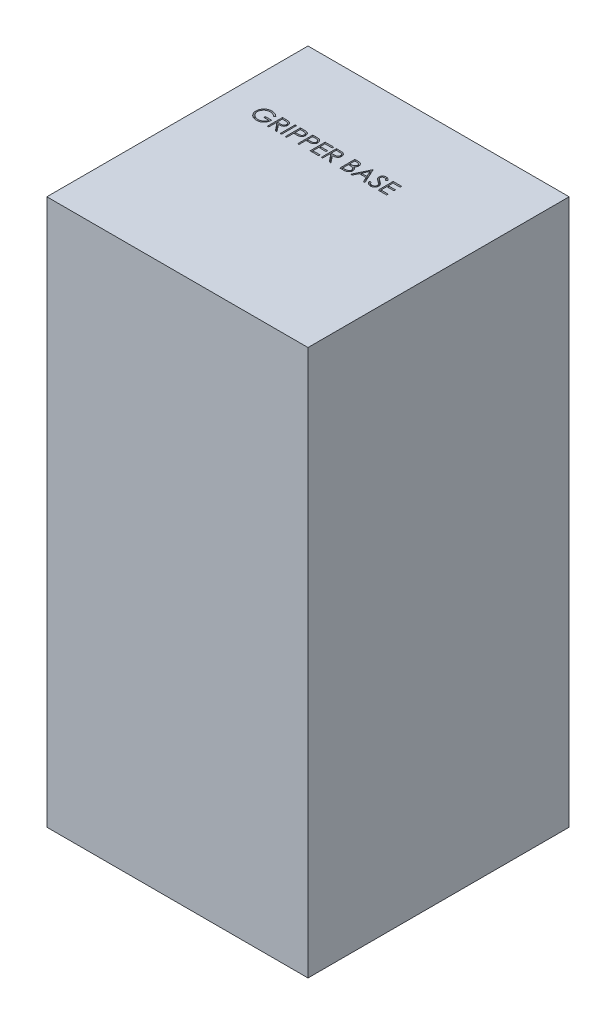
from build123d import *

# Parameters (mm, degrees)
SKETCH1_W           = 55
SKETCH1_H           = 55
BOSS_EXTRUDE1_DEPTH = 115
SKETCH2_W           = 0.284935897
SKETCH2_H           = 3.175
CUT_EXTRUDE1_DEPTH  = 1


with BuildPart() as part:
    # Sketch1 → Boss-Extrude1 (new body)
    with BuildSketch(Plane(origin=(0, 0, 0), x_dir=(1, 0, 0), z_dir=(0, 1, 0))):
        Rectangle(SKETCH1_W, SKETCH1_H)
    extrude(amount=BOSS_EXTRUDE1_DEPTH)

    # Sketch2 → Cut-Extrude1 (cut)
    # profile 1 of 11: a face of its own
    with BuildSketch(Plane(origin=(0, 115, 0), x_dir=(1, 0, 0), z_dir=(0, 1, 0))):
        with BuildLine():
            Line((-18.007065508, 11.228724722), (-18.251296277, 10.997214305))
            add(Edge.make_bspline(
                [(-18.251296277, 10.997214305), (-18.295491268, 11.038789445), (-18.382827396, 11.120948342), (-18.525212759, 11.227547602), (-18.67376977, 11.318866136), (-18.827723249, 11.393166793), (-18.983260652, 11.452451083), (-19.13831747, 11.494658753), (-19.291303214, 11.521575984), (-19.393054905, 11.524794862), (-19.443193312, 11.526380972)],
                knots=[0, 0, 0, 0, 1.08915593, 2.152340314, 3.188132944, 4.216796309, 5.218260357, 6.173443236, 7.099959455, 8, 8, 8, 8], degree=3))
            add(Edge.make_bspline(
                [(-19.443193312, 11.526380972), (-19.47395879, 11.526005772), (-19.535409954, 11.525256346), (-19.626688432, 11.515691237), (-19.717009595, 11.501934539), (-19.806202943, 11.482030121), (-19.894441895, 11.456803331), (-19.981419562, 11.425247947), (-20.067298191, 11.388458547), (-20.15126885, 11.345947588), (-20.232676307, 11.299248013), (-20.309562865, 11.247496837), (-20.382418591, 11.192352721), (-20.44987412, 11.132435046), (-20.512317467, 11.068286561), (-20.571234919, 11.001100562), (-20.624554323, 10.929041471), (-20.672715594, 10.853435082), (-20.715679348, 10.77560931), (-20.75360577, 10.696313241), (-20.785443842, 10.615809887), (-20.810634705, 10.533998231), (-20.831417941, 10.451511196), (-20.846038914, 10.367777628), (-20.854281869, 10.282707871), (-20.855707698, 10.225741786), (-20.856424482, 10.197104129)],
                knots=[0, 0, 0, 0, 1.02818874, 2.053710826, 3.065248034, 4.081641283, 5.106893873, 6.131558223, 7.173050175, 8.228653731, 9.27666206, 10.308777013, 11.325269123, 12.329503258, 13.32196095, 14.316845687, 15.314881793, 16.315733098, 17.311955233, 18.285320748, 19.252783886, 20.203351036, 21.145449891, 22.095197417, 23.042428769, 24, 24, 24, 24], degree=3))
            add(Edge.make_bspline(
                [(-20.856424482, 10.197104129), (-20.855738938, 10.167829888), (-20.854369721, 10.109361343), (-20.845606431, 10.022099577), (-20.829342956, 9.936133819), (-20.80760082, 9.851181584), (-20.780403937, 9.767097381), (-20.74650159, 9.684245747), (-20.706346367, 9.602629749), (-20.659867494, 9.522984768), (-20.608898581, 9.445403169), (-20.551800215, 9.372324174), (-20.491148114, 9.30277464), (-20.424732648, 9.238298769), (-20.354683492, 9.177171948), (-20.278907784, 9.121078296), (-20.198895552, 9.068937337), (-20.114524724, 9.021406208), (-20.026710772, 8.97894418), (-19.936670717, 8.94118536), (-19.844116913, 8.910089104), (-19.749535759, 8.884745252), (-19.653040005, 8.863971411), (-19.554139841, 8.850606947), (-19.453562456, 8.840908836), (-19.38576384, 8.840199749), (-19.351606774, 8.83984251)],
                knots=[0, 0, 0, 0, 0.93586088, 1.869166235, 2.799637598, 3.729985548, 4.670839027, 5.622275134, 6.589130586, 7.576015415, 8.568469353, 9.55398029, 10.53834874, 11.515998671, 12.510579167, 13.508179873, 14.527009472, 15.561807829, 16.601455013, 17.643573243, 18.680854198, 19.719860599, 20.772568776, 21.833555941, 22.908541556, 24, 24, 24, 24], degree=3))
            add(Edge.make_bspline(
                [(-19.351606774, 8.83984251), (-19.31044213, 8.840703005), (-19.229608665, 8.842392725), (-19.110785249, 8.855546559), (-18.996663892, 8.876090436), (-18.887565265, 8.906176642), (-18.783362653, 8.944552119), (-18.683674056, 8.990812219), (-18.589284337, 9.04673128), (-18.499909744, 9.109844717), (-18.417580012, 9.180161743), (-18.343326628, 9.256039213), (-18.278333934, 9.337108817), (-18.221633242, 9.422893067), (-18.174726106, 9.514102022), (-18.136224427, 9.610288704), (-18.106712084, 9.711496375), (-18.094597214, 9.781429499), (-18.088475764, 9.816765587)],
                knots=[0, 0, 0, 0, 1.13008108, 2.219097802, 3.278683437, 4.311054135, 5.322181354, 6.324827112, 7.324222904, 8.330512327, 9.32562643, 10.293043162, 11.24128371, 12.174520618, 13.111833804, 14.052305215, 15.015860969, 16, 16, 16, 16], degree=3))
            Line((-18.088475764, 9.816765587), (-19.146809098, 9.816765587))
            Line((-19.146809098, 9.816765587), (-19.146809098, 10.142406613))
            Line((-19.146809098, 10.142406613), (-17.803539867, 10.142406613))
            add(Edge.make_bspline(
                [(-17.803539867, 10.142406613), (-17.805087315, 10.081711962), (-17.808115951, 9.962921567), (-17.829360253, 9.78968425), (-17.863665232, 9.626061357), (-17.910528514, 9.471880571), (-17.971193947, 9.327360383), (-18.045010455, 9.192354061), (-18.133159451, 9.067733787), (-18.232501066, 8.952482191), (-18.343988884, 8.849676405), (-18.464610418, 8.75931959), (-18.594564954, 8.683207932), (-18.733729565, 8.62128576), (-18.881648672, 8.572958636), (-19.03866456, 8.53869442), (-19.204564298, 8.51816581), (-19.318262569, 8.515542916), (-19.376411461, 8.514201485)],
                knots=[0, 0, 0, 0, 1.140356446, 2.231883559, 3.274166699, 4.278491846, 5.25512956, 6.21435461, 7.1637429, 8.11826594, 9.068280886, 10.0076534, 10.945064095, 11.891975133, 12.864533718, 13.863980011, 14.907571808, 16, 16, 16, 16], degree=3))
            add(Edge.make_bspline(
                [(-19.376411461, 8.514201485), (-19.412252798, 8.514717759), (-19.482943467, 8.515736018), (-19.58734738, 8.522972612), (-19.68887265, 8.534112849), (-19.787504487, 8.550935925), (-19.883605697, 8.571541362), (-19.976696321, 8.597927171), (-20.067130972, 8.628469491), (-20.155049431, 8.663209138), (-20.239653698, 8.703460569), (-20.32132061, 8.748191456), (-20.400501595, 8.797171148), (-20.476657295, 8.851246701), (-20.550184509, 8.910013647), (-20.620609133, 8.973589773), (-20.688325422, 9.041780718), (-20.730743843, 9.090203105), (-20.752117591, 9.114602126)],
                knots=[0, 0, 0, 0, 1.107784379, 2.184907829, 3.233506516, 4.263428166, 5.276301166, 6.270063455, 7.25232949, 8.225834625, 9.190232166, 10.146266622, 11.1027726, 12.066435141, 13.031522626, 14.010570082, 14.99756817, 16, 16, 16, 16], degree=3))
            add(Edge.make_bspline(
                [(-20.752117591, 9.114602126), (-20.783129115, 9.153310504), (-20.844637404, 9.230084741), (-20.92381116, 9.353093262), (-20.991303861, 9.480457807), (-21.0460661, 9.612532934), (-21.088827078, 9.749195105), (-21.119494179, 9.890269691), (-21.13746222, 10.035938356), (-21.140050786, 10.134513274), (-21.14136038, 10.184383776)],
                knots=[0, 0, 0, 0, 1.023165419, 2.029347347, 3.013907458, 3.994755782, 4.975994455, 5.96558838, 6.970761222, 8, 8, 8, 8], degree=3))
            add(Edge.make_bspline(
                [(-21.14136038, 10.184383776), (-21.140877564, 10.221727449), (-21.139918068, 10.295940177), (-21.128283492, 10.406119306), (-21.111590778, 10.514342077), (-21.087055235, 10.620520025), (-21.056125052, 10.724724061), (-21.017522961, 10.827002571), (-20.972578663, 10.927415912), (-20.920340391, 11.025272921), (-20.862206632, 11.119275067), (-20.799114646, 11.209043931), (-20.730168523, 11.292944726), (-20.656494191, 11.372040007), (-20.577212635, 11.445336104), (-20.493066587, 11.513511619), (-20.403991197, 11.576658001), (-20.309706234, 11.633780637), (-20.211618977, 11.685091921), (-20.109964547, 11.730076421), (-20.004773975, 11.767254143), (-19.896835335, 11.798798928), (-19.785331602, 11.822126234), (-19.671071936, 11.839043311), (-19.553460763, 11.850618997), (-19.473962365, 11.851549958), (-19.433653048, 11.852021998)],
                knots=[0, 0, 0, 0, 1.008945113, 2.00506715, 2.99143336, 3.967273523, 4.948097931, 5.927297278, 6.919902385, 7.919676788, 8.923139349, 9.905703106, 10.883022732, 11.856032218, 12.825136022, 13.798837087, 14.781400844, 15.773989409, 16.776158564, 17.77167057, 18.775803737, 19.789618931, 20.80898985, 21.851988756, 22.910860228, 24, 24, 24, 24], degree=3))
            add(Edge.make_bspline(
                [(-19.433653048, 11.852021998), (-19.400779784, 11.851496316), (-19.335595965, 11.850453951), (-19.23859905, 11.843228877), (-19.143101387, 11.831777213), (-19.048961376, 11.816150057), (-18.956499601, 11.794865138), (-18.865452661, 11.769394122), (-18.775688575, 11.739737969), (-18.687488663, 11.704369516), (-18.600259878, 11.664225156), (-18.513517208, 11.619037266), (-18.427557035, 11.568033154), (-18.342230288, 11.511061376), (-18.256998902, 11.449100418), (-18.173210977, 11.380378156), (-18.08884402, 11.307604656), (-18.034595232, 11.255278675), (-18.007065508, 11.228724722)],
                knots=[0, 0, 0, 0, 0.985871117, 1.954866573, 2.915460327, 3.869826059, 4.81536089, 5.759505086, 6.70452669, 7.649098992, 8.607881297, 9.583363685, 10.581137262, 11.603961102, 12.659522466, 13.73993555, 14.853081303, 16, 16, 16, 16], degree=3))
        make_face()
    # profile 2 of 11: a face of its own
    with BuildSketch(Plane(origin=(0, 115, 0), x_dir=(1, 0, 0), z_dir=(0, 1, 0))):
        with BuildLine():
            Line((-17.152257815, 11.770611741), (-16.516876205, 11.770611741))
            add(Edge.make_bspline(
                [(-16.516876205, 11.770611741), (-16.474475324, 11.770470602), (-16.393060936, 11.770199601), (-16.276426612, 11.768688516), (-16.170447746, 11.764357493), (-16.075179748, 11.760630421), (-15.990624369, 11.75383416), (-15.916522326, 11.74733843), (-15.853214915, 11.73883518), (-15.814891893, 11.730938118), (-15.797540267, 11.727362542)],
                knots=[0, 0, 0, 0, 1.410062039, 2.707475311, 3.878576406, 4.937260626, 5.877586885, 6.699081471, 7.410979367, 8, 8, 8, 8], degree=3))
            add(Edge.make_bspline(
                [(-15.797540267, 11.727362542), (-15.774311401, 11.721623262), (-15.728349204, 11.710267137), (-15.662173072, 11.686264499), (-15.59911365, 11.658488125), (-15.539432881, 11.625863893), (-15.483429699, 11.588149629), (-15.43052666, 11.545996403), (-15.380483704, 11.499634867), (-15.335324653, 11.447896118), (-15.292744228, 11.393615855), (-15.256831688, 11.334920305), (-15.225874096, 11.273541633), (-15.201226555, 11.208855618), (-15.181380108, 11.141489583), (-15.167386305, 11.070833317), (-15.158994156, 10.997208718), (-15.158139759, 10.946991187), (-15.157706533, 10.921528208)],
                knots=[0, 0, 0, 0, 1.027469482, 2.033020251, 3.019912614, 3.986113645, 4.951240523, 5.91722682, 6.890402269, 7.87763091, 8.8651537, 9.85103654, 10.82876324, 11.815024772, 12.821070561, 13.842952187, 14.906261191, 16, 16, 16, 16], degree=3))
            add(Edge.make_bspline(
                [(-15.157706533, 10.921528208), (-15.159039125, 10.879223506), (-15.161639355, 10.796676075), (-15.185882842, 10.676877989), (-15.225594399, 10.565127683), (-15.28031624, 10.461565861), (-15.350002479, 10.368211204), (-15.433754253, 10.286214148), (-15.531618287, 10.217597942), (-15.622722023, 10.170015755), (-15.703198476, 10.139542188), (-15.769450124, 10.118100633), (-15.841719453, 10.101534422), (-15.919314036, 10.086693445), (-16.00255678, 10.075488694), (-16.091248173, 10.067282141), (-16.185451468, 10.062153111), (-16.250166195, 10.061389292), (-16.283457735, 10.060996357)],
                knots=[0, 0, 0, 0, 1.260483769, 2.459530307, 3.627416485, 4.787058657, 5.939039949, 7.08810263, 8.267026773, 9.491475466, 10.141966685, 10.831826277, 11.566392101, 12.351337768, 13.187381173, 14.07005841, 15.007169909, 16, 16, 16, 16], degree=3))
            Line((-16.283457735, 10.060996357), (-15.117001405, 8.595611741))
            Line((-15.117001405, 8.595611741), (-15.469355171, 8.595611741))
            Line((-15.469355171, 8.595611741), (-16.635811501, 10.060996357))
            Line((-16.635811501, 10.060996357), (-16.867321918, 10.060996357))
            Line((-16.867321918, 10.060996357), (-16.867321918, 8.595611741))
            Line((-16.867321918, 8.595611741), (-17.152257815, 8.595611741))
            Line((-17.152257815, 8.595611741), (-17.152257815, 11.770611741))
        make_face()
        with BuildLine():
            Line((-16.867321918, 11.444970716), (-16.867321918, 10.386637382))
            Line((-16.867321918, 10.386637382), (-16.286001806, 10.382185259))
            add(Edge.make_bspline(
                [(-16.286001806, 10.382185259), (-16.258860056, 10.382173251), (-16.206251615, 10.382149977), (-16.130141726, 10.385772903), (-16.059275625, 10.389894342), (-15.993924371, 10.396198391), (-15.934058771, 10.404322827), (-15.879708746, 10.414485534), (-15.830785577, 10.42632562), (-15.773727618, 10.44465138), (-15.71001305, 10.473685411), (-15.640769511, 10.515926971), (-15.581803105, 10.569057529), (-15.531984758, 10.629812021), (-15.49195306, 10.696610618), (-15.463729982, 10.76865261), (-15.445820766, 10.844119274), (-15.443708443, 10.895987986), (-15.442642431, 10.922164225)],
                knots=[0, 0, 0, 0, 1.146690395, 2.22261258, 3.21895312, 4.145990853, 4.996080663, 5.770904154, 6.481378293, 7.121626537, 8.300444488, 9.431385265, 10.535395872, 11.636531494, 12.74115979, 13.810798291, 14.895190096, 16, 16, 16, 16], degree=3))
            add(Edge.make_bspline(
                [(-15.442642431, 10.922164225), (-15.443732926, 10.947697189), (-15.445893891, 10.998294205), (-15.463536702, 11.072367781), (-15.49337207, 11.142278514), (-15.533578671, 11.207742011), (-15.582563619, 11.267165072), (-15.64000192, 11.318007846), (-15.704323062, 11.359962718), (-15.764440506, 11.386772763), (-15.818174399, 11.403210058), (-15.864828447, 11.414777185), (-15.917543859, 11.424070382), (-15.976576597, 11.431516266), (-16.041674648, 11.437916108), (-16.113167167, 11.44222665), (-16.190579817, 11.444779227), (-16.244234534, 11.444905401), (-16.272009418, 11.444970716)],
                knots=[0, 0, 0, 0, 1.101028733, 2.181837193, 3.264309656, 4.369019818, 5.486613113, 6.575447106, 7.666700264, 8.788928104, 9.402425223, 10.0903467, 10.862060571, 11.710948788, 12.657782767, 13.684531032, 14.801375019, 16, 16, 16, 16], degree=3))
            Line((-16.272009418, 11.444970716), (-16.867321918, 11.444970716))
        make_face(mode=Mode.SUBTRACT)
    # profile 3 of 11: a face of its own
    with BuildSketch(Plane(origin=(0, 115, 0), x_dir=(1, 0, 0), z_dir=(0, 1, 0))):
        with Locations((-14.323251406, 10.183111741)):
            Rectangle(SKETCH2_W, SKETCH2_H)
    # profile 4 of 11: a face of its own
    with BuildSketch(Plane(origin=(0, 115, 0), x_dir=(1, 0, 0), z_dir=(0, 1, 0))):
        with BuildLine():
            Line((-13.366680892, 11.770611741), (-12.744019634, 11.770611741))
            add(Edge.make_bspline(
                [(-12.744019634, 11.770611741), (-12.701192598, 11.770564664), (-12.619134095, 11.770474462), (-12.501464008, 11.767739657), (-12.394593752, 11.764086872), (-12.298753763, 11.759023297), (-12.21364916, 11.753039247), (-12.139665038, 11.744646326), (-12.076219869, 11.735883058), (-12.038204733, 11.726973639), (-12.020867591, 11.722910419)],
                knots=[0, 0, 0, 0, 1.415646017, 2.712440637, 3.8905458, 4.950247383, 5.884950622, 6.709939814, 7.411656543, 8, 8, 8, 8], degree=3))
            add(Edge.make_bspline(
                [(-12.020867591, 11.722910419), (-11.9989206, 11.716903365), (-11.95554377, 11.705030804), (-11.893040681, 11.681251212), (-11.833573979, 11.653055248), (-11.776939636, 11.620920674), (-11.723833604, 11.58346877), (-11.673463552, 11.542217702), (-11.626273999, 11.496215065), (-11.582530308, 11.445976822), (-11.54235767, 11.392346346), (-11.507768601, 11.334523038), (-11.478806045, 11.273480212), (-11.453965505, 11.20926033), (-11.436087122, 11.141324108), (-11.422618863, 11.07014359), (-11.414070286, 10.995726407), (-11.413251534, 10.944872099), (-11.412834739, 10.918984137)],
                knots=[0, 0, 0, 0, 0.999701418, 1.975846123, 2.934577507, 3.890451536, 4.834027766, 5.787354733, 6.749476667, 7.726910423, 8.712836071, 9.690891519, 10.682875813, 11.679750201, 12.712814741, 13.765529915, 14.8625177, 16, 16, 16, 16], degree=3))
            add(Edge.make_bspline(
                [(-11.412834739, 10.918984137), (-11.413217031, 10.892878582), (-11.413965012, 10.841801302), (-11.422942357, 10.767077415), (-11.435034745, 10.69566859), (-11.453628499, 10.62773316), (-11.47798136, 10.563674568), (-11.506549151, 10.502513879), (-11.541005639, 10.445291605), (-11.580597734, 10.391800006), (-11.624640966, 10.341988871), (-11.672948989, 10.296219164), (-11.725326776, 10.2547588), (-11.781607867, 10.217514831), (-11.842340944, 10.185350921), (-11.906604898, 10.156542508), (-11.974958309, 10.132348046), (-12.022259018, 10.119620776), (-12.046308296, 10.113149802)],
                knots=[0, 0, 0, 0, 1.121902311, 2.195077645, 3.232258892, 4.234102512, 5.217864754, 6.176164875, 7.132989551, 8.084763148, 9.034132444, 9.988522005, 10.94243251, 11.903244335, 12.886203696, 13.894208494, 14.929344452, 16, 16, 16, 16], degree=3))
            add(Edge.make_bspline(
                [(-12.046308296, 10.113149802), (-12.066199521, 10.108919812), (-12.109792295, 10.099649543), (-12.181586051, 10.089300443), (-12.265175079, 10.080467048), (-12.36044529, 10.073843873), (-12.467311168, 10.068173896), (-12.585830523, 10.063667125), (-12.716236008, 10.061190758), (-12.80719635, 10.061063039), (-12.854686702, 10.060996357)],
                knots=[0, 0, 0, 0, 0.601384939, 1.31797006, 2.144135048, 3.087295005, 4.142315834, 5.309527816, 6.595305764, 8, 8, 8, 8], degree=3))
            Line((-12.854686702, 10.060996357), (-13.081744995, 10.060996357))
            Line((-13.081744995, 10.060996357), (-13.081744995, 8.595611741))
            Line((-13.081744995, 8.595611741), (-13.366680892, 8.595611741))
            Line((-13.366680892, 8.595611741), (-13.366680892, 11.770611741))
        make_face()
        with BuildLine():
            Line((-13.081744995, 11.444970716), (-13.081744995, 10.386637382))
            Line((-13.081744995, 10.386637382), (-12.525865588, 10.379641188))
            add(Edge.make_bspline(
                [(-12.525865588, 10.379641188), (-12.498723941, 10.379627161), (-12.446327551, 10.37960008), (-12.370638977, 10.383215247), (-12.300417695, 10.387388588), (-12.235879402, 10.393499033), (-12.176995004, 10.402136173), (-12.123666317, 10.410855393), (-12.076306853, 10.423469543), (-12.020881149, 10.440454042), (-11.959119826, 10.469421486), (-11.891929979, 10.511467458), (-11.83498809, 10.5650621), (-11.785713635, 10.625321633), (-11.746610446, 10.6923587), (-11.717984653, 10.764085521), (-11.701165174, 10.839766499), (-11.698909841, 10.891553596), (-11.697770636, 10.917712102)],
                knots=[0, 0, 0, 0, 1.160613943, 2.240541288, 3.23993089, 4.169200891, 5.011653406, 5.7853311, 6.478053781, 7.106038997, 8.262395093, 9.384106736, 10.481365981, 11.59014053, 12.70357646, 13.786202915, 14.881775077, 16, 16, 16, 16], degree=3))
            add(Edge.make_bspline(
                [(-11.697770636, 10.917712102), (-11.698916037, 10.943237753), (-11.701192952, 10.993979589), (-11.718116485, 11.068346036), (-11.746554791, 11.139316997), (-11.78597613, 11.20551401), (-11.833819869, 11.265556711), (-11.889427131, 11.317714819), (-11.952667018, 11.359644506), (-12.011493627, 11.386707555), (-12.063746132, 11.403231412), (-12.109132267, 11.414792803), (-12.160377379, 11.424023531), (-12.21749815, 11.431497937), (-12.280051849, 11.437896434), (-12.348575892, 11.442237999), (-12.422810697, 11.44477932), (-12.474346001, 11.444905373), (-12.5010609, 11.444970716)],
                knots=[0, 0, 0, 0, 1.120700087, 2.227813068, 3.331159281, 4.466773991, 5.599788987, 6.693661531, 7.80175334, 8.91857717, 9.525282508, 10.207424825, 10.974604443, 11.810962634, 12.737642355, 13.736264703, 14.826523623, 16, 16, 16, 16], degree=3))
            Line((-12.5010609, 11.444970716), (-13.081744995, 11.444970716))
        make_face(mode=Mode.SUBTRACT)
    # profile 5 of 11: a face of its own
    with BuildSketch(Plane(origin=(0, 115, 0), x_dir=(1, 0, 0), z_dir=(0, 1, 0))):
        with BuildLine():
            Line((-10.761552687, 11.770611741), (-10.138891429, 11.770611741))
            add(Edge.make_bspline(
                [(-10.138891429, 11.770611741), (-10.096064393, 11.770564664), (-10.01400589, 11.770474462), (-9.896335803, 11.767739657), (-9.789465547, 11.764086872), (-9.693625558, 11.759023297), (-9.608520955, 11.753039247), (-9.534536833, 11.744646326), (-9.471091664, 11.735883058), (-9.433076528, 11.726973639), (-9.415739386, 11.722910419)],
                knots=[0, 0, 0, 0, 1.415646017, 2.712440637, 3.8905458, 4.950247383, 5.884950622, 6.709939814, 7.411656543, 8, 8, 8, 8], degree=3))
            add(Edge.make_bspline(
                [(-9.415739386, 11.722910419), (-9.393792395, 11.716903365), (-9.350415565, 11.705030804), (-9.287912476, 11.681251212), (-9.228445774, 11.653055248), (-9.171811431, 11.620920674), (-9.118705399, 11.58346877), (-9.068335347, 11.542217702), (-9.021145794, 11.496215065), (-8.977402103, 11.445976822), (-8.937229465, 11.392346346), (-8.902640395, 11.334523038), (-8.873677839, 11.273480212), (-8.8488373, 11.20926033), (-8.830958917, 11.141324108), (-8.817490658, 11.07014359), (-8.808942081, 10.995726407), (-8.808123329, 10.944872099), (-8.807706533, 10.918984137)],
                knots=[0, 0, 0, 0, 0.999701418, 1.975846123, 2.934577507, 3.890451536, 4.834027766, 5.787354733, 6.749476667, 7.726910423, 8.712836071, 9.690891519, 10.682875813, 11.679750201, 12.712814741, 13.765529915, 14.8625177, 16, 16, 16, 16], degree=3))
            add(Edge.make_bspline(
                [(-8.807706533, 10.918984137), (-8.808088826, 10.892878582), (-8.808836807, 10.841801302), (-8.817814151, 10.767077415), (-8.82990654, 10.69566859), (-8.848500294, 10.62773316), (-8.872853155, 10.563674568), (-8.901420946, 10.502513879), (-8.935877434, 10.445291605), (-8.975469529, 10.391800006), (-9.019512761, 10.341988871), (-9.067820784, 10.296219164), (-9.120198571, 10.2547588), (-9.176479662, 10.217514831), (-9.237212739, 10.185350921), (-9.301476693, 10.156542508), (-9.369830103, 10.132348046), (-9.417130813, 10.119620776), (-9.441180091, 10.113149802)],
                knots=[0, 0, 0, 0, 1.121902311, 2.195077645, 3.232258892, 4.234102512, 5.217864754, 6.176164875, 7.132989551, 8.084763148, 9.034132444, 9.988522005, 10.94243251, 11.903244335, 12.886203696, 13.894208494, 14.929344452, 16, 16, 16, 16], degree=3))
            add(Edge.make_bspline(
                [(-9.441180091, 10.113149802), (-9.461071316, 10.108919812), (-9.50466409, 10.099649543), (-9.576457845, 10.089300443), (-9.660046874, 10.080467048), (-9.755317085, 10.073843873), (-9.862182963, 10.068173896), (-9.980702318, 10.063667125), (-10.111107802, 10.061190758), (-10.202068145, 10.061063039), (-10.249558497, 10.060996357)],
                knots=[0, 0, 0, 0, 0.601384939, 1.31797006, 2.144135048, 3.087295005, 4.142315834, 5.309527816, 6.595305764, 8, 8, 8, 8], degree=3))
            Line((-10.249558497, 10.060996357), (-10.47661679, 10.060996357))
            Line((-10.47661679, 10.060996357), (-10.47661679, 8.595611741))
            Line((-10.47661679, 8.595611741), (-10.761552687, 8.595611741))
            Line((-10.761552687, 8.595611741), (-10.761552687, 11.770611741))
        make_face()
        with BuildLine():
            Line((-10.47661679, 11.444970716), (-10.47661679, 10.386637382))
            Line((-10.47661679, 10.386637382), (-9.920737383, 10.379641188))
            add(Edge.make_bspline(
                [(-9.920737383, 10.379641188), (-9.893595736, 10.379627161), (-9.841199346, 10.37960008), (-9.765510772, 10.383215247), (-9.69528949, 10.387388588), (-9.630751197, 10.393499033), (-9.571866799, 10.402136173), (-9.518538112, 10.410855393), (-9.471178648, 10.423469543), (-9.415752944, 10.440454042), (-9.353991621, 10.469421486), (-9.286801774, 10.511467458), (-9.229859885, 10.5650621), (-9.18058543, 10.625321633), (-9.14148224, 10.6923587), (-9.112856447, 10.764085521), (-9.096036969, 10.839766499), (-9.093781636, 10.891553596), (-9.092642431, 10.917712102)],
                knots=[0, 0, 0, 0, 1.160613943, 2.240541288, 3.23993089, 4.169200891, 5.011653406, 5.7853311, 6.478053781, 7.106038997, 8.262395093, 9.384106736, 10.481365981, 11.59014053, 12.70357646, 13.786202915, 14.881775077, 16, 16, 16, 16], degree=3))
            add(Edge.make_bspline(
                [(-9.092642431, 10.917712102), (-9.093787832, 10.943237753), (-9.096064747, 10.993979589), (-9.11298828, 11.068346036), (-9.141426586, 11.139316997), (-9.180847925, 11.20551401), (-9.228691664, 11.265556711), (-9.284298926, 11.317714819), (-9.347538813, 11.359644506), (-9.406365422, 11.386707555), (-9.458617927, 11.403231412), (-9.504004062, 11.414792803), (-9.555249174, 11.424023531), (-9.612369945, 11.431497937), (-9.674923644, 11.437896434), (-9.743447687, 11.442237999), (-9.817682492, 11.44477932), (-9.869217796, 11.444905373), (-9.895932695, 11.444970716)],
                knots=[0, 0, 0, 0, 1.120700087, 2.227813068, 3.331159281, 4.466773991, 5.599788987, 6.693661531, 7.80175334, 8.91857717, 9.525282508, 10.207424825, 10.974604443, 11.810962634, 12.737642355, 13.736264703, 14.826523623, 16, 16, 16, 16], degree=3))
            Line((-9.895932695, 11.444970716), (-10.47661679, 11.444970716))
        make_face(mode=Mode.SUBTRACT)
    # profile 6 of 11: a face of its own
    with BuildSketch(Plane(origin=(0, 115, 0), x_dir=(1, 0, 0), z_dir=(0, 1, 0))):
        Polygon((-8.156424482, 11.770611741), (-6.365398841, 11.770611741), (-6.365398841, 11.444970716), (-7.871488585, 11.444970716), (-7.871488585, 10.468047639), (-6.365398841, 10.468047639), (-6.365398841, 10.142406613), (-7.871488585, 10.142406613), (-7.871488585, 8.921252767), (-6.365398841, 8.921252767), (-6.365398841, 8.595611741), (-8.156424482, 8.595611741), align=None)
    # profile 7 of 11: a face of its own
    with BuildSketch(Plane(origin=(0, 115, 0), x_dir=(1, 0, 0), z_dir=(0, 1, 0))):
        with BuildLine():
            Line((-5.795527046, 11.770611741), (-5.160145436, 11.770611741))
            add(Edge.make_bspline(
                [(-5.160145436, 11.770611741), (-5.117744555, 11.770470602), (-5.036330167, 11.770199601), (-4.919695843, 11.768688516), (-4.813716976, 11.764357493), (-4.718448979, 11.760630421), (-4.633893599, 11.75383416), (-4.559791557, 11.74733843), (-4.496484146, 11.73883518), (-4.458161123, 11.730938118), (-4.440809498, 11.727362542)],
                knots=[0, 0, 0, 0, 1.410062039, 2.707475311, 3.878576406, 4.937260626, 5.877586885, 6.699081471, 7.410979367, 8, 8, 8, 8], degree=3))
            add(Edge.make_bspline(
                [(-4.440809498, 11.727362542), (-4.417580632, 11.721623262), (-4.371618434, 11.710267137), (-4.305442303, 11.686264499), (-4.242382881, 11.658488125), (-4.182702111, 11.625863893), (-4.126698929, 11.588149629), (-4.07379589, 11.545996403), (-4.023752934, 11.499634867), (-3.978593884, 11.447896118), (-3.936013459, 11.393615855), (-3.900100919, 11.334920305), (-3.869143327, 11.273541633), (-3.844495786, 11.208855618), (-3.824649339, 11.141489583), (-3.810655536, 11.070833317), (-3.802263387, 10.997208718), (-3.80140899, 10.946991187), (-3.800975764, 10.921528208)],
                knots=[0, 0, 0, 0, 1.027469482, 2.033020251, 3.019912614, 3.986113645, 4.951240523, 5.91722682, 6.890402269, 7.87763091, 8.8651537, 9.85103654, 10.82876324, 11.815024772, 12.821070561, 13.842952187, 14.906261191, 16, 16, 16, 16], degree=3))
            add(Edge.make_bspline(
                [(-3.800975764, 10.921528208), (-3.802308355, 10.879223506), (-3.804908586, 10.796676075), (-3.829152073, 10.676877989), (-3.86886363, 10.565127683), (-3.923585471, 10.461565861), (-3.993271709, 10.368211204), (-4.077023484, 10.286214148), (-4.174887517, 10.217597942), (-4.265991254, 10.170015755), (-4.346467707, 10.139542188), (-4.412719355, 10.118100633), (-4.484988684, 10.101534422), (-4.562583266, 10.086693445), (-4.645826011, 10.075488694), (-4.734517404, 10.067282141), (-4.828720699, 10.062153111), (-4.893435426, 10.061389292), (-4.926726966, 10.060996357)],
                knots=[0, 0, 0, 0, 1.260483769, 2.459530307, 3.627416485, 4.787058657, 5.939039949, 7.08810263, 8.267026773, 9.491475466, 10.141966685, 10.831826277, 11.566392101, 12.351337768, 13.187381173, 14.07005841, 15.007169909, 16, 16, 16, 16], degree=3))
            Line((-4.926726966, 10.060996357), (-3.760270636, 8.595611741))
            Line((-3.760270636, 8.595611741), (-4.112624402, 8.595611741))
            Line((-4.112624402, 8.595611741), (-5.279080732, 10.060996357))
            Line((-5.279080732, 10.060996357), (-5.510591149, 10.060996357))
            Line((-5.510591149, 10.060996357), (-5.510591149, 8.595611741))
            Line((-5.510591149, 8.595611741), (-5.795527046, 8.595611741))
            Line((-5.795527046, 8.595611741), (-5.795527046, 11.770611741))
        make_face()
        with BuildLine():
            Line((-5.510591149, 11.444970716), (-5.510591149, 10.386637382))
            Line((-5.510591149, 10.386637382), (-4.929271037, 10.382185259))
            add(Edge.make_bspline(
                [(-4.929271037, 10.382185259), (-4.902129287, 10.382173251), (-4.849520846, 10.382149977), (-4.773410957, 10.385772903), (-4.702544856, 10.389894342), (-4.637193602, 10.396198391), (-4.577328002, 10.404322827), (-4.522977977, 10.414485534), (-4.474054808, 10.42632562), (-4.416996848, 10.44465138), (-4.353282281, 10.473685411), (-4.284038742, 10.515926971), (-4.225072336, 10.569057529), (-4.175253989, 10.629812021), (-4.135222291, 10.696610618), (-4.106999213, 10.76865261), (-4.089089997, 10.844119274), (-4.086977674, 10.895987986), (-4.085911662, 10.922164225)],
                knots=[0, 0, 0, 0, 1.146690395, 2.22261258, 3.21895312, 4.145990853, 4.996080663, 5.770904154, 6.481378293, 7.121626537, 8.300444488, 9.431385265, 10.535395872, 11.636531494, 12.74115979, 13.810798291, 14.895190096, 16, 16, 16, 16], degree=3))
            add(Edge.make_bspline(
                [(-4.085911662, 10.922164225), (-4.087002157, 10.947697189), (-4.089163121, 10.998294205), (-4.106805933, 11.072367781), (-4.1366413, 11.142278514), (-4.176847902, 11.207742011), (-4.22583285, 11.267165072), (-4.283271151, 11.318007846), (-4.347592292, 11.359962718), (-4.407709737, 11.386772763), (-4.461443629, 11.403210058), (-4.508097678, 11.414777185), (-4.56081309, 11.424070382), (-4.619845828, 11.431516266), (-4.684943878, 11.437916108), (-4.756436398, 11.44222665), (-4.833849048, 11.444779227), (-4.887503764, 11.444905401), (-4.915278649, 11.444970716)],
                knots=[0, 0, 0, 0, 1.101028733, 2.181837193, 3.264309656, 4.369019818, 5.486613113, 6.575447106, 7.666700264, 8.788928104, 9.402425223, 10.0903467, 10.862060571, 11.710948788, 12.657782767, 13.684531032, 14.801375019, 16, 16, 16, 16], degree=3))
            Line((-4.915278649, 11.444970716), (-5.510591149, 11.444970716))
        make_face(mode=Mode.SUBTRACT)
    # profile 8 of 11: a face of its own
    with BuildSketch(Plane(origin=(0, 115, 0), x_dir=(1, 0, 0), z_dir=(0, 1, 0))):
        with BuildLine():
            Line((-1.887834739, 11.770611741), (-1.268353569, 11.770611741))
            add(Edge.make_bspline(
                [(-1.268353569, 11.770611741), (-1.238029163, 11.77045231), (-1.179252919, 11.770143294), (-1.093782425, 11.765350739), (-1.013728147, 11.758815982), (-0.939066868, 11.748447255), (-0.869833088, 11.735936143), (-0.80581816, 11.72078521), (-0.747225647, 11.70261821), (-0.677273378, 11.673729083), (-0.597516779, 11.630800209), (-0.511158237, 11.567365011), (-0.437312963, 11.489774848), (-0.373643946, 11.402251296), (-0.323024359, 11.305970989), (-0.28640364, 11.203228725), (-0.263218996, 11.095349716), (-0.26083463, 11.021287691), (-0.25962961, 10.983857935)],
                knots=[0, 0, 0, 0, 1.001505555, 1.941167018, 2.826882275, 3.653841531, 4.429895133, 5.150066043, 5.825578002, 6.45369114, 7.647487171, 8.808567382, 9.977351308, 11.170798116, 12.373658725, 13.556498008, 14.765093433, 16, 16, 16, 16], degree=3))
            add(Edge.make_bspline(
                [(-0.25962961, 10.983857935), (-0.260621316, 10.948794545), (-0.26257011, 10.879891678), (-0.281205328, 10.77911345), (-0.310379648, 10.683181987), (-0.350933696, 10.592447395), (-0.403640506, 10.50895976), (-0.466104838, 10.432045597), (-0.541467366, 10.364961424), (-0.597930877, 10.327457505), (-0.626611782, 10.308407214)],
                knots=[0, 0, 0, 0, 1.044552857, 2.05264487, 3.044412934, 4.028983338, 5.005914585, 5.980388656, 6.974128949, 8, 8, 8, 8], degree=3))
            add(Edge.make_bspline(
                [(-0.626611782, 10.308407214), (-0.590543394, 10.294559679), (-0.521535633, 10.268065915), (-0.426570465, 10.221225173), (-0.344750855, 10.170278115), (-0.27544773, 10.114641366), (-0.216177143, 10.05467123), (-0.164421975, 9.989488376), (-0.120261014, 9.918242503), (-0.082421433, 9.841676439), (-0.052895062, 9.760572), (-0.030782634, 9.675689939), (-0.018112162, 9.587334628), (-0.016309088, 9.527204319), (-0.015398841, 9.49684872)],
                knots=[0, 0, 0, 0, 1.27268992, 2.434971085, 3.483601985, 4.442670788, 5.356604649, 6.2567628, 7.179492994, 8.113709626, 9.066344395, 10.018646069, 10.999752585, 12, 12, 12, 12], degree=3))
            add(Edge.make_bspline(
                [(-0.015398841, 9.49684872), (-0.01628498, 9.465854486), (-0.018028483, 9.404872463), (-0.030891743, 9.315287448), (-0.052671433, 9.229675889), (-0.082671687, 9.147484045), (-0.121826073, 9.068870923), (-0.16947644, 8.993747462), (-0.226292216, 8.922868462), (-0.289849247, 8.855446318), (-0.361751336, 8.794823968), (-0.439326342, 8.74083472), (-0.523551218, 8.696433649), (-0.61304267, 8.659135544), (-0.708804585, 8.630644728), (-0.810406951, 8.610712465), (-0.917762139, 8.597282181), (-0.991430984, 8.596178003), (-1.02921094, 8.595611741)],
                knots=[0, 0, 0, 0, 0.978564426, 1.925352924, 2.850884081, 3.763762016, 4.682927383, 5.618979971, 6.567305752, 7.547517671, 8.540179244, 9.531824382, 10.526200242, 11.540722885, 12.589160233, 13.674978461, 14.80764778, 16, 16, 16, 16], degree=3))
            Line((-1.02921094, 8.595611741), (-1.887834739, 8.595611741))
            Line((-1.887834739, 8.595611741), (-1.887834739, 11.770611741))
        make_face()
        with BuildLine():
            Line((-1.602898841, 11.444970716), (-1.602898841, 10.42734251))
            Line((-1.602898841, 10.42734251), (-1.411457535, 10.42734251))
            add(Edge.make_bspline(
                [(-1.411457535, 10.42734251), (-1.383473271, 10.427705298), (-1.329401969, 10.428406277), (-1.251097491, 10.430414253), (-1.178412654, 10.436036764), (-1.111472919, 10.441657659), (-1.050383702, 10.450796749), (-0.995280342, 10.461675317), (-0.945298043, 10.473180524), (-0.887658599, 10.49274713), (-0.822278138, 10.521664736), (-0.752579537, 10.566542758), (-0.691134696, 10.619995564), (-0.639248676, 10.68167308), (-0.596783985, 10.749587406), (-0.5672894, 10.822654933), (-0.547289364, 10.899054624), (-0.545482761, 10.951504039), (-0.544565508, 10.978133776)],
                knots=[0, 0, 0, 0, 1.156816544, 2.235205308, 3.236616184, 4.169592532, 5.011045266, 5.787822928, 6.49130361, 7.128639758, 8.301311294, 9.436451833, 10.541879658, 11.654887649, 12.756523258, 13.837046038, 14.901820046, 16, 16, 16, 16], degree=3))
            add(Edge.make_bspline(
                [(-0.544565508, 10.978133776), (-0.545042828, 10.995755726), (-0.545979145, 11.030323105), (-0.553647498, 11.080714305), (-0.56668094, 11.128106852), (-0.583421621, 11.173150224), (-0.606815646, 11.214435973), (-0.634359644, 11.253391587), (-0.667638806, 11.288690437), (-0.705518654, 11.321682768), (-0.749069334, 11.350933161), (-0.798264863, 11.376551567), (-0.853770827, 11.3971807), (-0.914651774, 11.415247496), (-0.981844832, 11.427936877), (-1.054574605, 11.438508164), (-1.133436815, 11.443890009), (-1.187997015, 11.444602445), (-1.216200123, 11.444970716)],
                knots=[0, 0, 0, 0, 0.91205012, 1.789085906, 2.630437955, 3.453916878, 4.269457761, 5.079663411, 5.91843418, 6.774407191, 7.675494373, 8.627863946, 9.638891023, 10.736472738, 11.911756761, 13.175263542, 14.539845004, 16, 16, 16, 16], degree=3))
            Line((-1.216200123, 11.444970716), (-1.602898841, 11.444970716))
        make_face(mode=Mode.SUBTRACT)
        with BuildLine():
            Line((-1.602898841, 10.101701485), (-1.602898841, 8.921252767))
            Line((-1.602898841, 8.921252767), (-1.197119594, 8.921252767))
            add(Edge.make_bspline(
                [(-1.197119594, 8.921252767), (-1.168073854, 8.921600881), (-1.11209202, 8.922271824), (-1.031264475, 8.92446217), (-0.956349803, 8.929444448), (-0.887689851, 8.937287469), (-0.824543226, 8.945795062), (-0.767667453, 8.957235296), (-0.716601484, 8.970342567), (-0.657388362, 8.990602852), (-0.59071018, 9.022077508), (-0.518854617, 9.069533985), (-0.454967976, 9.126070128), (-0.400716063, 9.191503172), (-0.35625428, 9.26265159), (-0.323909689, 9.3380763), (-0.30396084, 9.416531028), (-0.301545872, 9.47002226), (-0.300334739, 9.49684872)],
                knots=[0, 0, 0, 0, 1.160039823, 2.235823828, 3.228722157, 4.157150951, 4.99529583, 5.772374946, 6.472645482, 7.099169577, 8.269452708, 9.405989375, 10.527446681, 11.663510218, 12.788923519, 13.866172445, 14.929861265, 16, 16, 16, 16], degree=3))
            add(Edge.make_bspline(
                [(-0.300334739, 9.49684872), (-0.300585205, 9.513624822), (-0.301082097, 9.546906426), (-0.308575655, 9.595815776), (-0.319473951, 9.643192104), (-0.33356318, 9.689164054), (-0.354082268, 9.732900474), (-0.378036777, 9.775266367), (-0.406123191, 9.816317738), (-0.449887542, 9.868217425), (-0.513543556, 9.928013572), (-0.603991845, 9.986558307), (-0.706836716, 10.033773103), (-0.781428798, 10.053820485), (-0.819961141, 10.064176445)],
                knots=[0, 0, 0, 0, 0.723448775, 1.435228256, 2.130040452, 2.821711965, 3.505591119, 4.210454504, 4.921174351, 5.648778258, 7.137944449, 8.670945889, 10.280296675, 12, 12, 12, 12], degree=3))
            add(Edge.make_bspline(
                [(-0.819961141, 10.064176445), (-0.835408963, 10.067310699), (-0.868903029, 10.07410641), (-0.923519906, 10.081279827), (-0.985873158, 10.087670703), (-1.056106768, 10.092397967), (-1.134309596, 10.097284332), (-1.220648658, 10.099184634), (-1.314771365, 10.10145182), (-1.380078731, 10.101616134), (-1.414001606, 10.101701485)],
                knots=[0, 0, 0, 0, 0.634451884, 1.375622551, 2.216452059, 3.157844607, 4.20941857, 5.370758133, 6.634282058, 8, 8, 8, 8], degree=3))
            Line((-1.414001606, 10.101701485), (-1.602898841, 10.101701485))
        make_face(mode=Mode.SUBTRACT)
    # profile 9 of 11: a face of its own
    with BuildSketch(Plane(origin=(0, 115, 0), x_dir=(1, 0, 0), z_dir=(0, 1, 0))):
        Polygon((1.938447313, 11.770611741), (3.403831928, 8.595611741), (3.094091343, 8.595611741), (2.624710334, 9.613239946), (1.185402441, 9.613239946), (0.702665061, 8.595611741), (0.391652441, 8.595611741), (1.897742185, 11.770611741), align=None)
        Polygon((1.91491466, 11.151766589), (1.339954725, 9.938880972), (2.474610173, 9.938880972), align=None, mode=Mode.SUBTRACT)
    # profile 10 of 11: a face of its own
    with BuildSketch(Plane(origin=(0, 115, 0), x_dir=(1, 0, 0), z_dir=(0, 1, 0))):
        with BuildLine():
            Line((3.648062697, 9.208096717), (3.916462136, 9.369009177))
            add(Edge.make_bspline(
                [(3.916462136, 9.369009177), (3.941425109, 9.327222199), (3.989253201, 9.247159963), (4.069037648, 9.138975883), (4.151708217, 9.047025926), (4.237877113, 8.971845004), (4.327018366, 8.912654942), (4.4197139, 8.870742918), (4.515651343, 8.844602712), (4.580941881, 8.841427633), (4.613537457, 8.83984251)],
                knots=[0, 0, 0, 0, 1.272034388, 2.437168799, 3.508375237, 4.49857839, 5.41946034, 6.295179144, 7.148887113, 8, 8, 8, 8], degree=3))
            add(Edge.make_bspline(
                [(4.613537457, 8.83984251), (4.641374823, 8.840617821), (4.696562467, 8.842154875), (4.777808216, 8.856923888), (4.856713137, 8.879613462), (4.931650973, 8.912108164), (5.001587709, 8.951422362), (5.062916639, 8.998907823), (5.115935614, 9.052072024), (5.15930531, 9.111383432), (5.192579342, 9.175171131), (5.218153576, 9.24064503), (5.232345893, 9.308833659), (5.234483805, 9.354744579), (5.235562697, 9.377913424)],
                knots=[0, 0, 0, 0, 1.095163259, 2.171163733, 3.241058638, 4.321873601, 5.38011039, 6.391990106, 7.366004449, 8.327778327, 9.272591725, 10.192022065, 11.087607919, 12, 12, 12, 12], degree=3))
            add(Edge.make_bspline(
                [(5.235562697, 9.377913424), (5.234225287, 9.404348338), (5.231506527, 9.458086654), (5.208527256, 9.537370625), (5.172378296, 9.615831742), (5.139029326, 9.664365033), (5.121715542, 9.689562062)],
                knots=[0, 0, 0, 0, 0.938893495, 1.908633276, 2.914225137, 4, 4, 4, 4], degree=3))
            add(Edge.make_bspline(
                [(5.121715542, 9.689562062), (5.107500056, 9.707747395), (5.077656422, 9.745925226), (5.026350678, 9.802753404), (4.966147132, 9.861371541), (4.89910605, 9.924017971), (4.822785319, 9.987779044), (4.73957536, 10.055695268), (4.647351716, 10.125183841), (4.582672887, 10.171786097), (4.549299676, 10.195832094)],
                knots=[0, 0, 0, 0, 0.722233717, 1.516239348, 2.393582979, 3.351407094, 4.387010283, 5.505090956, 6.712668013, 8, 8, 8, 8], degree=3))
            add(Edge.make_bspline(
                [(4.549299676, 10.195832094), (4.515895051, 10.21962517), (4.452027952, 10.265115719), (4.362711952, 10.332629177), (4.282843046, 10.394354687), (4.212776224, 10.450873326), (4.152542304, 10.502192761), (4.101666639, 10.547820177), (4.061445233, 10.58898955), (4.039079099, 10.615697053), (4.029037257, 10.627688063)],
                knots=[0, 0, 0, 0, 1.452282411, 2.77665338, 3.964542531, 5.026858415, 5.96415736, 6.766646006, 7.446254459, 8, 8, 8, 8], degree=3))
            add(Edge.make_bspline(
                [(4.029037257, 10.627688063), (4.015001448, 10.646376147), (3.987398146, 10.683128771), (3.950961841, 10.740573463), (3.919992743, 10.799377425), (3.895715485, 10.859698674), (3.875271915, 10.92069036), (3.861521506, 10.983148275), (3.852911453, 11.046792165), (3.852029723, 11.089621555), (3.851588338, 11.111061461)],
                knots=[0, 0, 0, 0, 1.068054152, 2.10047183, 3.106115577, 4.101338837, 5.06977816, 6.043150881, 7.020423561, 8, 8, 8, 8], degree=3))
            add(Edge.make_bspline(
                [(3.851588338, 11.111061461), (3.852772349, 11.144652756), (3.855115064, 11.211117357), (3.874927533, 11.30820961), (3.906199372, 11.400907289), (3.950009735, 11.488292663), (4.006486048, 11.568090374), (4.071842039, 11.641218323), (4.149685316, 11.702694108), (4.235095196, 11.756407904), (4.328582047, 11.798450279), (4.426545224, 11.830164883), (4.529140425, 11.848134709), (4.598630411, 11.850713503), (4.633890021, 11.852021998)],
                knots=[0, 0, 0, 0, 1.005424448, 1.989358655, 2.955360095, 3.929531133, 4.905563448, 5.876582895, 6.856512386, 7.866279853, 8.892233794, 9.918561126, 10.94386622, 12, 12, 12, 12], degree=3))
            add(Edge.make_bspline(
                [(4.633890021, 11.852021998), (4.671304312, 11.85073154), (4.745709395, 11.848165232), (4.85515547, 11.825851757), (4.960529834, 11.788930433), (5.045296224, 11.747030722), (5.111638086, 11.705182938), (5.162231922, 11.667064955), (5.213501324, 11.62318182), (5.265859845, 11.573416647), (5.3184203, 11.517312809), (5.371963004, 11.455254541), (5.426613162, 11.387621094), (5.461770263, 11.339338868), (5.479793467, 11.314587102)],
                knots=[0, 0, 0, 0, 1.286793592, 2.559021753, 3.825965368, 5.121522368, 5.803751409, 6.523245864, 7.299691795, 8.125521123, 9.008227632, 9.944561021, 10.946284179, 12, 12, 12, 12], degree=3))
            Line((5.479793467, 11.314587102), (5.222206327, 11.11932969))
            add(Edge.make_bspline(
                [(5.222206327, 11.11932969), (5.206652517, 11.139367288), (5.176699515, 11.177955016), (5.131224909, 11.231994709), (5.088363636, 11.28135823), (5.046135773, 11.324234453), (5.00677155, 11.362971389), (4.968565376, 11.396136311), (4.932067072, 11.424054172), (4.886059589, 11.453847973), (4.828258516, 11.483381373), (4.755701115, 11.508372322), (4.679876423, 11.523390129), (4.628233114, 11.525375762), (4.60208914, 11.526380972)],
                knots=[0, 0, 0, 0, 1.181633172, 2.275549214, 3.290209073, 4.226197932, 5.078386478, 5.862611352, 6.581680152, 7.217281963, 8.414376989, 9.595101626, 10.782541182, 12, 12, 12, 12], degree=3))
            add(Edge.make_bspline(
                [(4.60208914, 11.526380972), (4.569290009, 11.525281787), (4.506039974, 11.523162112), (4.416241689, 11.50001184), (4.335420771, 11.463561152), (4.265976658, 11.412475422), (4.208158115, 11.35194995), (4.166333877, 11.28230056), (4.141160514, 11.205390809), (4.138088674, 11.151740878), (4.136524236, 11.124417831)],
                knots=[0, 0, 0, 0, 1.14458467, 2.207223713, 3.21896685, 4.227309161, 5.202851033, 6.127160689, 7.046193047, 8, 8, 8, 8], degree=3))
            add(Edge.make_bspline(
                [(4.136524236, 11.124417831), (4.136880858, 11.107407561), (4.137594685, 11.073359206), (4.147550394, 11.023056845), (4.1603405, 10.972881559), (4.180608459, 10.92305893), (4.208589556, 10.872717618), (4.245333537, 10.820990756), (4.291609898, 10.767422421), (4.327058331, 10.732581446), (4.345774035, 10.714186461)],
                knots=[0, 0, 0, 0, 0.858281714, 1.717966888, 2.583508476, 3.4729293, 4.427298488, 5.488583878, 6.674047936, 8, 8, 8, 8], degree=3))
            add(Edge.make_bspline(
                [(4.345774035, 10.714186461), (4.352723995, 10.707984302), (4.369235507, 10.693249391), (4.399421525, 10.669126394), (4.439283921, 10.639369593), (4.487781775, 10.602551099), (4.54580931, 10.559841487), (4.613372908, 10.511786853), (4.689719441, 10.456827187), (4.74389575, 10.418402846), (4.772541864, 10.3980857)],
                knots=[0, 0, 0, 0, 0.420754252, 0.999615792, 1.744751191, 2.668019286, 3.750313428, 4.999500688, 6.413464383, 8, 8, 8, 8], degree=3))
            add(Edge.make_bspline(
                [(4.772541864, 10.3980857), (4.807000514, 10.373011038), (4.873724914, 10.32445743), (4.96866429, 10.25150892), (5.05474653, 10.180164159), (5.132273865, 10.110878758), (5.202012203, 10.044178274), (5.26318785, 9.979260246), (5.316424145, 9.916589762), (5.373736722, 9.836241783), (5.432299887, 9.737561799), (5.482593254, 9.616659397), (5.51430547, 9.495287021), (5.518452487, 9.413710533), (5.520498595, 9.373461301)],
                knots=[0, 0, 0, 0, 1.163667725, 2.253281268, 3.268753668, 4.215851969, 5.092017293, 5.902905408, 6.650798638, 7.335211899, 8.59617414, 9.77448103, 10.901945474, 12, 12, 12, 12], degree=3))
            add(Edge.make_bspline(
                [(5.520498595, 9.373461301), (5.519902477, 9.344996641), (5.518721817, 9.288620086), (5.50515013, 9.205838695), (5.485265863, 9.125437834), (5.455296372, 9.048411325), (5.418717507, 8.973350005), (5.372302411, 8.902222838), (5.318501868, 8.833455605), (5.256785524, 8.768882009), (5.189252456, 8.709603674), (5.117875104, 8.656872311), (5.042536642, 8.612904618), (4.963645769, 8.577026354), (4.881184364, 8.548965234), (4.79518016, 8.52863356), (4.705491389, 8.516155165), (4.644530952, 8.514859982), (4.613537457, 8.514201485)],
                knots=[0, 0, 0, 0, 0.983748083, 1.948392443, 2.894712957, 3.844097841, 4.80183111, 5.778335162, 6.776009319, 7.81870978, 8.863265674, 9.881300176, 10.883814829, 11.87499822, 12.874611388, 13.892143829, 14.928324115, 16, 16, 16, 16], degree=3))
            add(Edge.make_bspline(
                [(4.613537457, 8.514201485), (4.589556824, 8.5146652), (4.541897571, 8.515586789), (4.471403969, 8.523734093), (4.402334485, 8.535261252), (4.335555815, 8.553562015), (4.270207591, 8.57576613), (4.206574028, 8.603105903), (4.144624287, 8.635869364), (4.084011194, 8.673329851), (4.024888907, 8.716925091), (3.967811961, 8.767701048), (3.910907628, 8.824257328), (3.85585549, 8.888129767), (3.801541995, 8.958286457), (3.749038009, 9.035383788), (3.697256737, 9.119001816), (3.664766991, 9.177843715), (3.648062697, 9.208096717)],
                knots=[0, 0, 0, 0, 0.915332311, 1.819136955, 2.706846663, 3.586547465, 4.459518054, 5.340707479, 6.227863349, 7.133153174, 8.059268498, 9.028702269, 10.047606654, 11.120612155, 12.245963614, 13.433783089, 14.680604001, 16, 16, 16, 16], degree=3))
        make_face()
    # profile 11 of 11: a face of its own
    with BuildSketch(Plane(origin=(0, 115, 0), x_dir=(1, 0, 0), z_dir=(0, 1, 0))):
        Polygon((6.171780646, 11.770611741), (7.962806287, 11.770611741), (7.962806287, 11.444970716), (6.456716543, 11.444970716), (6.456716543, 10.468047639), (7.962806287, 10.468047639), (7.962806287, 10.142406613), (6.456716543, 10.142406613), (6.456716543, 8.921252767), (7.962806287, 8.921252767), (7.962806287, 8.595611741), (6.171780646, 8.595611741), align=None)
    extrude(amount=-CUT_EXTRUDE1_DEPTH, mode=Mode.SUBTRACT)


solid = part.part
